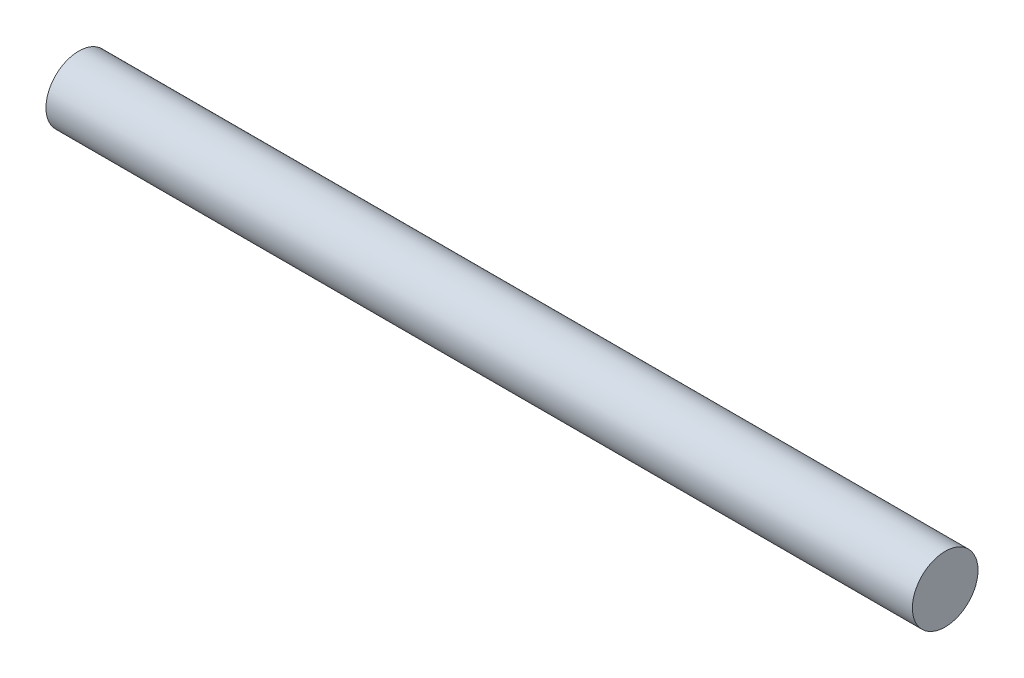
from build123d import *

# Parameters (mm, degrees)
SKETCH_233_R      = 75
EXTRUDE_273_DEPTH = 1980


with BuildPart() as part:
    # Sketch 233 → Extrude 273 (new body)
    with BuildSketch(Plane(origin=(0, 0, 0), x_dir=(0, 0, -1), z_dir=(1, 0, 0))):
        Circle(SKETCH_233_R)
    extrude(amount=EXTRUDE_273_DEPTH)


solid = part.part
